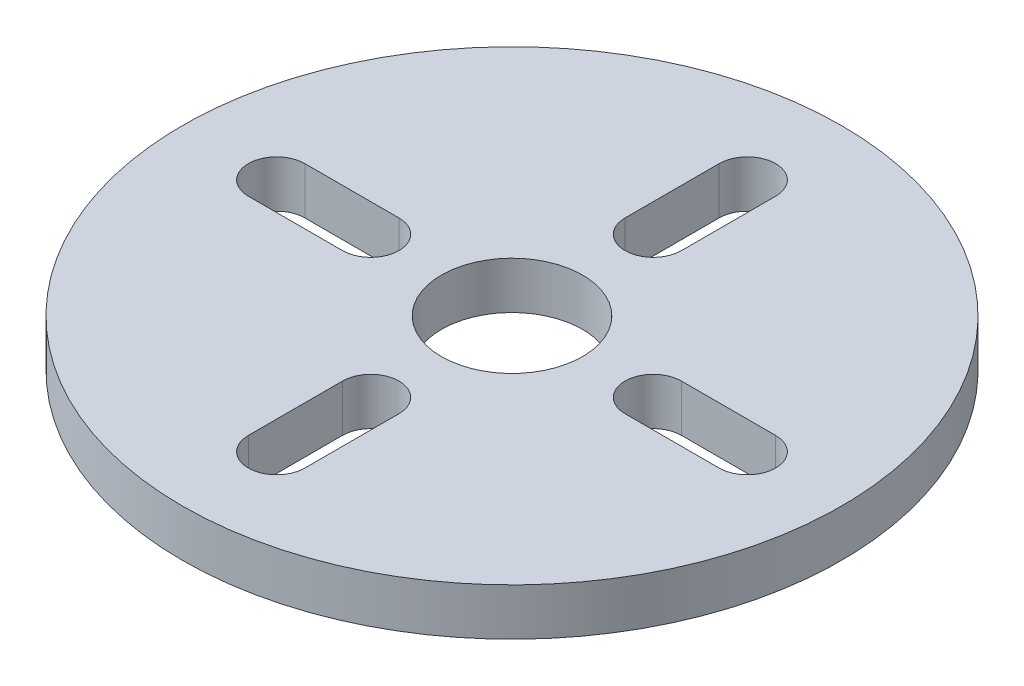
from build123d import *

# Parameters (mm, degrees)
SKETCH1_R           = 14
BOSS_EXTRUDE1_DEPTH = 2
SKETCH2_R           = 3
CUT_EXTRUDE1_DEPTH  = 20.899748742


with BuildPart() as part:
    # Sketch1 → Boss-Extrude1 (new body)
    with BuildSketch(Plane(origin=(0, 0, 0), x_dir=(1, 0, 0), z_dir=(0, 1, 0))):
        with Locations(Location((0, 0, 0), (0, 0, 270))):
            Circle(SKETCH1_R)
    extrude(amount=BOSS_EXTRUDE1_DEPTH)

    # Sketch2 → Cut-Extrude1 (cut, through all)
    with BuildSketch(Plane(origin=(0, 2, 0), x_dir=(1, 0, 0), z_dir=(0, 1, 0))):
        with Locations(Location((0, 0, 0), (0, 0, 270))):
            Circle(SKETCH2_R)
        with BuildLine():
            Line((1.2, 10), (1.2, 6))
            ThreePointArc((1.2, 6), (0, 4.8), (-1.2, 6))
            Line((-1.2, 6), (-1.2, 10))
            ThreePointArc((-1.2, 10), (0, 11.2), (1.2, 10))
        make_face()
        with BuildLine():
            Line((10, -1.2), (6, -1.2))
            ThreePointArc((6, -1.2), (4.8, 0), (6, 1.2))
            Line((6, 1.2), (10, 1.2))
            ThreePointArc((10, 1.2), (11.2, 0), (10, -1.2))
        make_face()
        with BuildLine():
            Line((-1.2, -10), (-1.2, -6))
            ThreePointArc((-1.2, -6), (0, -4.8), (1.2, -6))
            Line((1.2, -6), (1.2, -10))
            ThreePointArc((1.2, -10), (0, -11.2), (-1.2, -10))
        make_face()
        with BuildLine():
            Line((-10, 1.2), (-6, 1.2))
            ThreePointArc((-6, 1.2), (-4.8, 0), (-6, -1.2))
            Line((-6, -1.2), (-10, -1.2))
            ThreePointArc((-10, -1.2), (-11.2, 0), (-10, 1.2))
        make_face()
    extrude(amount=-CUT_EXTRUDE1_DEPTH, mode=Mode.SUBTRACT)


solid = part.part
